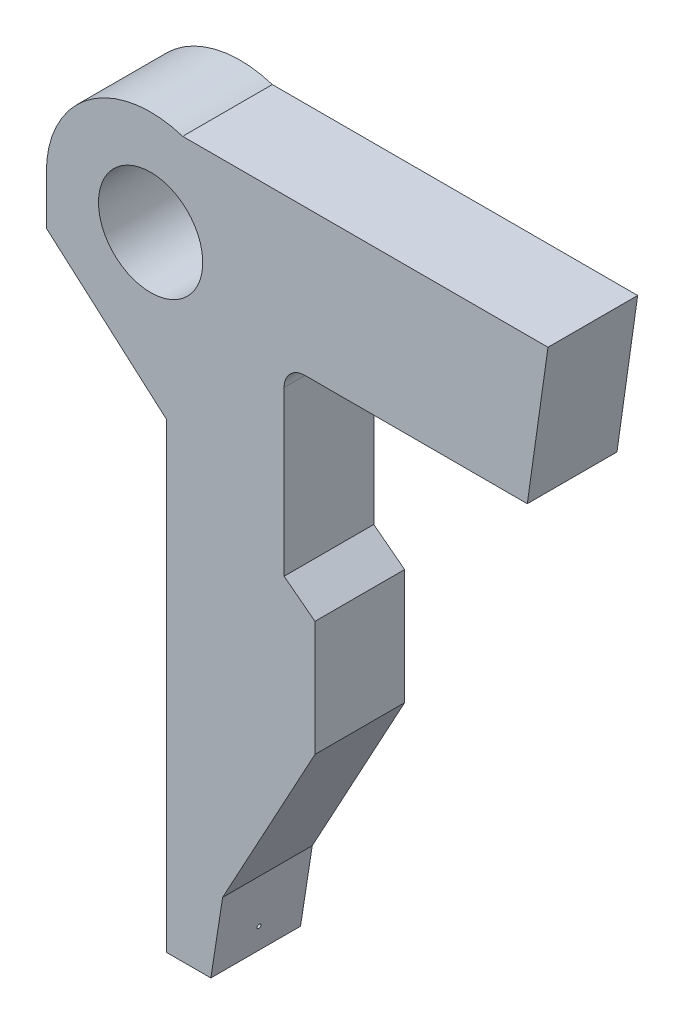
from build123d import *

# Parameters (mm, degrees)
SKETCH_1_R          = 5
SKETCH_1_R_2        = 2.5
EXTRUDE_1_DEPTH     = 4.3
SKETCH_3_R          = 1.825
CUT_EXTRUDE_1_DEPTH = 1.8
CUT_EXTRUDE_2_REACH = 36.091
SKETCH_4_R          = 0.1


with BuildPart() as part:
    # 스케치1 → 보스-돌출1 (new body)
    # profile 1 of 2: a face of its own
    with BuildSketch(Plane.XY):
        with BuildLine():
            ThreePointArc((5, 0), (0, -5), (-5, 0))
            Line((-5, 0), (-5, -2.326474397))
            Line((-5, -2.326474397), (0.754164722, -7.377840375))
            Line((0.754164722, -7.377840375), (0.754164722, -29.519890116))
            Line((0.754164722, -29.519890116), (2.889052882, -29.519890116))
            Line((2.889052882, -29.519890116), (3.452626944, -25.890848407))
            Line((3.452626944, -25.890848407), (7.880357437, -17.740939791))
            Line((7.880357437, -17.740939791), (7.880357437, -12.211059606))
            Line((7.880357437, -12.211059606), (6.40208237, -11.079255258))
            Line((6.40208237, -11.079255258), (6.40208237, -3.237610212))
            ThreePointArc((6.40208237, -3.237610212), (6.694975589, -2.530503431), (7.40208237, -2.237610212))
            Line((7.40208237, -2.237610212), (18.063612226, -2.237610212))
            Line((18.063612226, -2.237610212), (19.056002599, 4.757997197))
            Line((19.056002599, 4.757997197), (1.536705134, 4.757997197))
            ThreePointArc((1.536705134, 4.757997197), (4.04249463, 2.942488261), (5, 0))
        make_face()
    # profile 2 of 2: a face of its own
    with BuildSketch(Plane.XY):
        Circle(SKETCH_1_R)
        with Locations(Location((0, 0, 0), (0, 0, 180))):
            Circle(SKETCH_1_R_2, mode=Mode.SUBTRACT)
    extrude(amount=EXTRUDE_1_DEPTH)

    # 스케치3 → 컷-돌출1 (cut)
    with BuildSketch(Plane.ZY.offset(-0.754164722)):
        with Locations((2.174780249, -27.020012931)):
            Circle(SKETCH_3_R)
    extrude(amount=-CUT_EXTRUDE_1_DEPTH, mode=Mode.SUBTRACT)

    # 컷-돌출2: up to this plane
    cut_extrude_2_end = Plane(origin=(7.297372122, -1.133249487, 4.3), z_dir=(-0.9881554576984991, 0.15345615471746255, 0))
    # 스케치4 → 컷-돌출2 (cut, up to the surface)
    with BuildSketch(Plane.ZY.offset(-2.554164722), mode=Mode.PRIVATE) as cut_extrude_2_sk1:
        with Locations((2.174780249, -28.345012931)):
            Circle(SKETCH_4_R)
    cut_extrude_2_tool1 = split(extrude(cut_extrude_2_sk1.sketch, amount=-CUT_EXTRUDE_2_REACH, mode=Mode.PRIVATE), bisect_by=cut_extrude_2_end, keep=Keep.BOTH, mode=Mode.PRIVATE)
    add(cut_extrude_2_tool1.solids().sort_by_distance((2.554165, -28.345013, 2.17478))[0], mode=Mode.SUBTRACT)


solid = part.part
